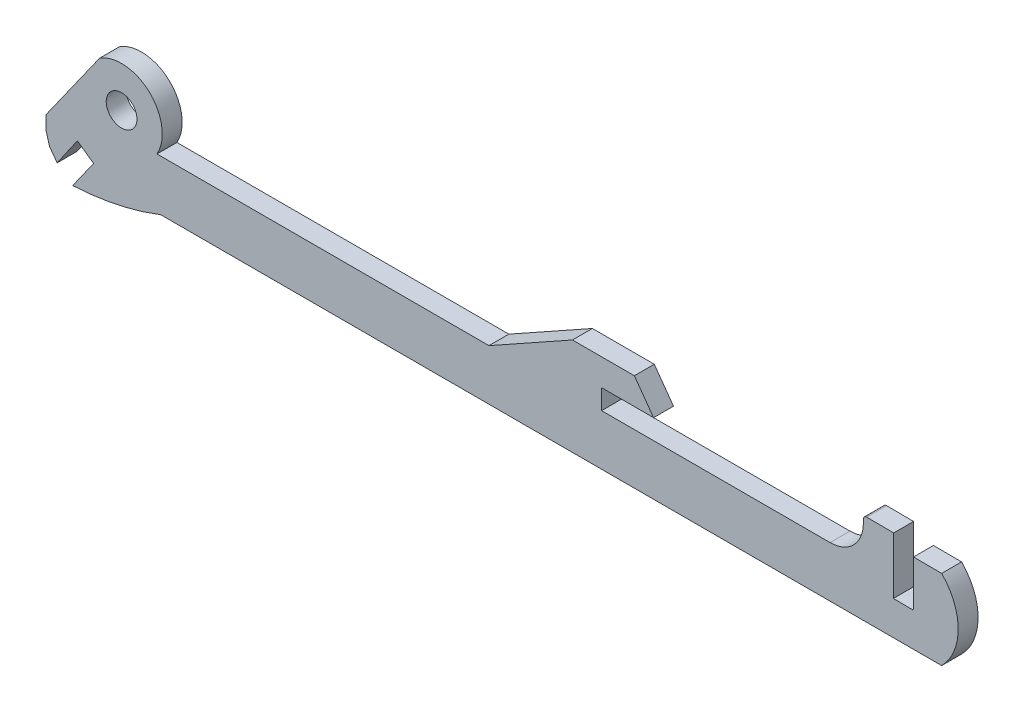
from build123d import *

# Parameters (mm, degrees)
SKETCH1_R          = 2.314653827
BASE_EXTRUDE_DEPTH = 3


with BuildPart() as part:
    # Sketch1 → Base-Extrude (new body)
    with BuildSketch(Plane.XY):
        with BuildLine():
            Line((1237.912051302, -106.965442143), (1245.987496986, -95.560571197))
            ThreePointArc((1245.987496986, -95.560571197), (1253.509408231, -96.263863256), (1254.634364731, -103.73435463))
            Line((1254.634364731, -103.73435463), (1304.653724872, -103.73435463))
            Line((1304.653724872, -103.73435463), (1317.227321876, -96.706912395))
            Line((1317.227321876, -96.706912395), (1326.560817804, -96.706912395))
            Line((1326.560817804, -96.706912395), (1329.452389013, -100.73435463))
            Line((1329.452389013, -100.73435463), (1321.620543519, -100.73435463))
            Line((1321.620543519, -100.73435463), (1321.620543519, -103.73435463))
            Line((1321.620543519, -103.73435463), (1356.049186006, -103.73435463))
            ThreePointArc((1356.049186006, -103.73435463), (1359.51702166, -102.336314635), (1361.045588138, -98.92400098))
            Line((1361.045588138, -98.92400098), (1361.062528583, -98.477689842))
            Line((1361.062528583, -98.477689842), (1361.062528583, -98.158287995))
            ThreePointArc((1361.062528583, -98.158287995), (1361.210092551, -97.803620765), (1361.565683957, -97.658297951))
            Line((1361.565683957, -97.658297951), (1365.63036841, -97.683949663))
            Line((1365.63036841, -97.683949663), (1365.576237812, -106.261303213))
            Line((1365.576237812, -106.261303213), (1368.576237812, -106.280235835))
            Line((1368.576237812, -106.280235835), (1368.620142395, -99.323262365))
            Line((1368.620142395, -99.323262365), (1372.856385089, -99.349996759))
            ThreePointArc((1372.856385089, -99.349996759), (1375.348322676, -105.366702643), (1372.855935111, -111.383222141))
            Line((1372.855935111, -111.383222141), (1255.179553467, -111.383222141))
            ThreePointArc((1255.179553467, -111.383222141), (1248.674645996, -113.340903741), (1241.936111152, -114.200256171))
            Line((1241.936111152, -114.200256171), (1245.086093213, -109.745869716))
            Line((1245.086093213, -109.745869716), (1242.636669623, -108.013725357))
            Line((1242.636669623, -108.013725357), (1239.591696444, -112.41591336))
            Line((1239.591696444, -112.41591336), (1238.460322727, -110.884264434))
            Line((1238.460322727, -110.884264434), (1237.923801474, -109.055713836))
            Line((1237.923801474, -109.055713836), (1237.912051302, -106.965442143))
        make_face()
        with Locations((1249.299132798, -100.717822078)):
            Circle(SKETCH1_R, mode=Mode.SUBTRACT)
    extrude(amount=BASE_EXTRUDE_DEPTH)


solid = part.part
